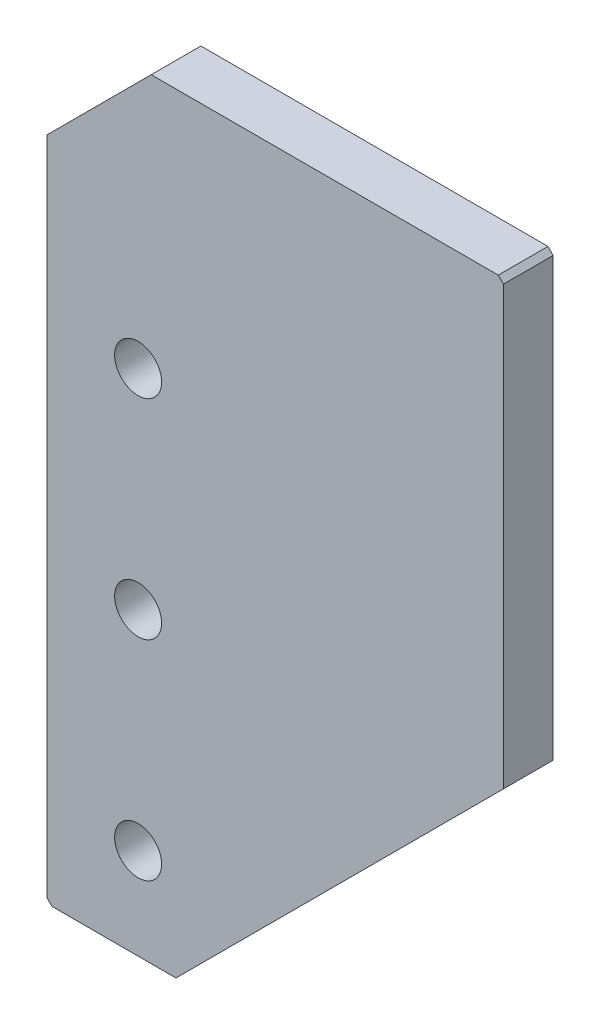
from build123d import *

# Parameters (mm, degrees)
BOSS_EXTRUDE1_DEPTH  = 4.7625
M8_CLEARANCE_HOLE1_D = 9
CHAMFER1_SIZE        = 1


with BuildPart() as part:
    # Sketch1 → Boss-Extrude1 (new, symmetric)
    with BuildSketch(Plane.XY):
        Polygon((-72.5, -37.5), (-47.751262658, -37.5), (15, 25.251262658), (15, 110), (-52.5, 110), (-72.5, 90), align=None)
    extrude(amount=BOSS_EXTRUDE1_DEPTH, both=True)

    # M8 Clearance Hole1 (through all)
    with Locations(Plane.XY.offset(4.7625)):
        with Locations((-55, 60), (-55, 20), (-55, -20)):
            Hole(M8_CLEARANCE_HOLE1_D / 2)

    # Chamfer1
    chamfer1_edges = [part.edges().sort_by_distance(p)[0] for p in [
        (15, 110, 0),
        (-72.5, -37.5, 0),
    ]]
    chamfer(chamfer1_edges, length=CHAMFER1_SIZE)


solid = part.part
